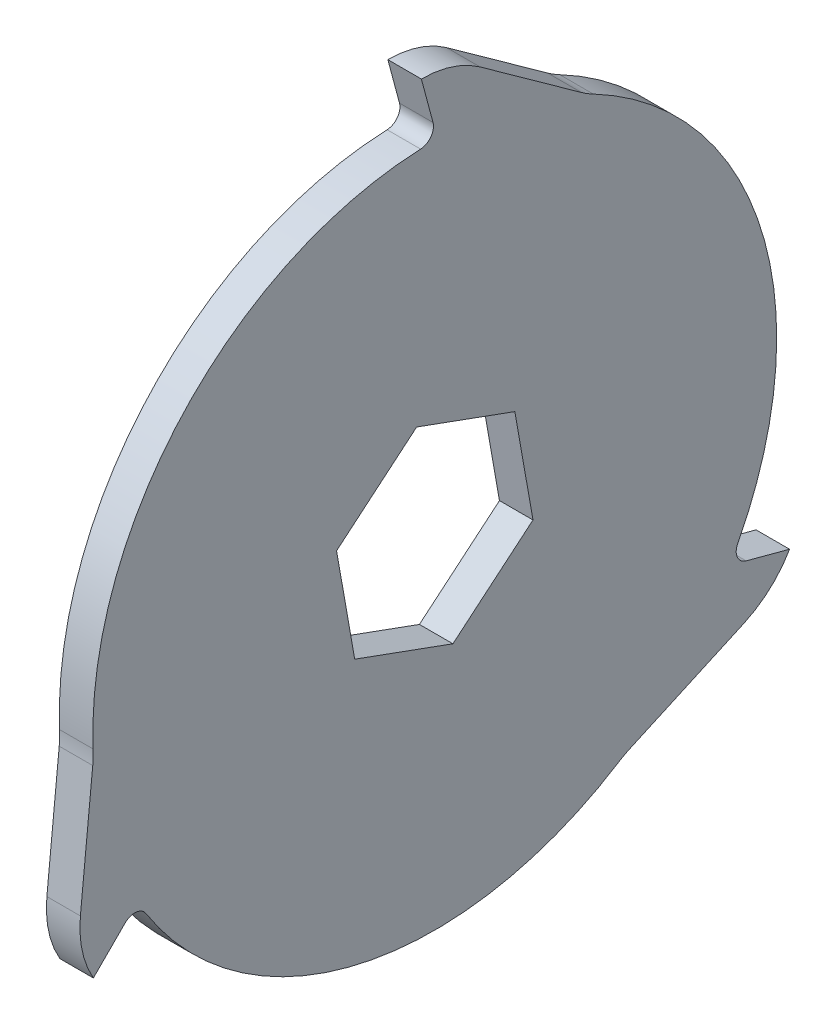
from build123d import *

# Parameters (mm, degrees)
SKETCH1_R         = 51
EXTRUDE1_DEPTH    = 2.5
EXTRUDE2_DEPTH    = 2.5
CIRPATTERN1_COUNT = 3


with BuildPart() as part:
    # Sketch1 → Extrude1 (new, symmetric)
    with BuildSketch(Plane(origin=(0, 0, 0), x_dir=(0, 0, -1), z_dir=(1, 0, 0))):
        Circle(SKETCH1_R)
        Polygon((11.941451067, 10.020067186), (-2.706907197, 15.351633575), (-14.648358264, 5.331566389), (-11.941451067, -10.020067186), (2.706907197, -15.351633575), (14.648358264, -5.331566389), align=None, mode=Mode.SUBTRACT)
    extrude(amount=EXTRUDE1_DEPTH, both=True)

    # Sketch2 → Extrude2 (add, symmetric)
    with BuildSketch(Plane(origin=(0, 0, 0), x_dir=(0, 0, -1), z_dir=(1, 0, 0))):
        with BuildLine():
            Line((-2, 59.956265369), (-0.262596806, 53.472188376))
            ThreePointArc((-0.262596806, 53.472188376), (-0.582870999, 51.770144067), (-2.111639083, 50.956265369))
            ThreePointArc((-2.111639083, 50.956265369), (11.148765219, 49.766505142), (23.649399595, 45.185239833))
            ThreePointArc((23.649399595, 45.185239833), (22.732801751, 45.706819988), (21.855117489, 46.291514612))
            Line((21.855117489, 46.291514612), (6.74998787, 57.139767012))
            ThreePointArc((6.74998787, 57.139767012), (2.596056753, 59.234789884), (-2, 59.956265369))
        make_face()
    extrude2 = extrude(amount=EXTRUDE2_DEPTH, both=True)

    # CirPattern1: Extrude2 ×3 about axis
    cirpattern1_axis = Axis((-5.5, 0, 0), (1, 0, 0))
    for i in range(1, CIRPATTERN1_COUNT):
        add(extrude2.rotate(cirpattern1_axis, i * 360 / CIRPATTERN1_COUNT))


solid = part.part
